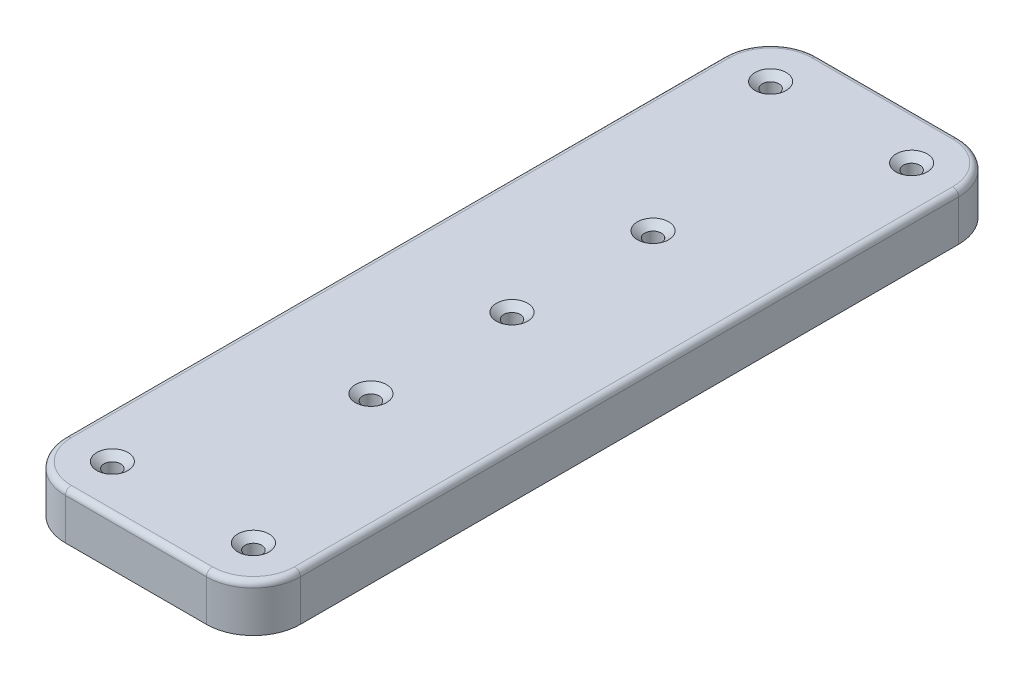
from build123d import *

# Parameters (mm, degrees)
SKETCH1_W                                         = 63.5
SKETCH1_H                                         = 12.7
BOSS_EXTRUDE1_DEPTH                               = 101.6
FILLET1_R                                         = 12.7
CSK_FOR_8_FLAT_HEAD_MACHINE_SCREW_100_D           = 4.4958
CSK_FOR_8_FLAT_HEAD_MACHINE_SCREW_100_CSINK_D     = 8.4328
CSK_FOR_8_FLAT_HEAD_MACHINE_SCREW_100_CSINK_ANGLE = 100
FILLET2_R                                         = 1.5875


with BuildPart() as part:
    # Sketch1 → Boss-Extrude1 (new, symmetric)
    with BuildSketch(Plane.XY):
        Rectangle(SKETCH1_W, SKETCH1_H)
    extrude(amount=BOSS_EXTRUDE1_DEPTH, both=True)

    # Fillet1
    fillet1_edges = [part.edges().sort_by_distance(p)[0] for p in [
        (-31.75, 0, 101.6),
        (31.75, 0, 101.6),
        (-31.75, 0, -101.6),
        (31.75, 0, -101.6),
    ]]
    fillet(fillet1_edges, radius=FILLET1_R)

    # CSK for #8 Flat Head Machine Screw (100)1 (through all)
    with Locations(Plane(origin=(0, 6.35, 0), x_dir=(1, 0, 0), z_dir=(0, 1, 0))):
        with Locations((19.05, -88.9), (-19.05, -88.9), (-19.05, 88.9), (19.05, 88.9), (0, -38.1), (0, 38.1), (0, 0)):
            CounterSinkHole(CSK_FOR_8_FLAT_HEAD_MACHINE_SCREW_100_D / 2, CSK_FOR_8_FLAT_HEAD_MACHINE_SCREW_100_CSINK_D / 2, counter_sink_angle=CSK_FOR_8_FLAT_HEAD_MACHINE_SCREW_100_CSINK_ANGLE)

    # Fillet2
    fillet2_edges = [part.edges().sort_by_distance(p)[0] for p in [
        (-31.75, 6.35, 0),
        (0, 6.35, -101.6),
        (0, 6.35, 101.6),
        (31.75, 6.35, 0),
        (28.030256121, 6.35, 97.880256121),
        (-28.030256121, 6.35, 97.880256121),
        (28.030256121, 6.35, -97.880256121),
        (-28.030256121, 6.35, -97.880256121),
    ]]
    fillet(fillet2_edges, radius=FILLET2_R)


solid = part.part
